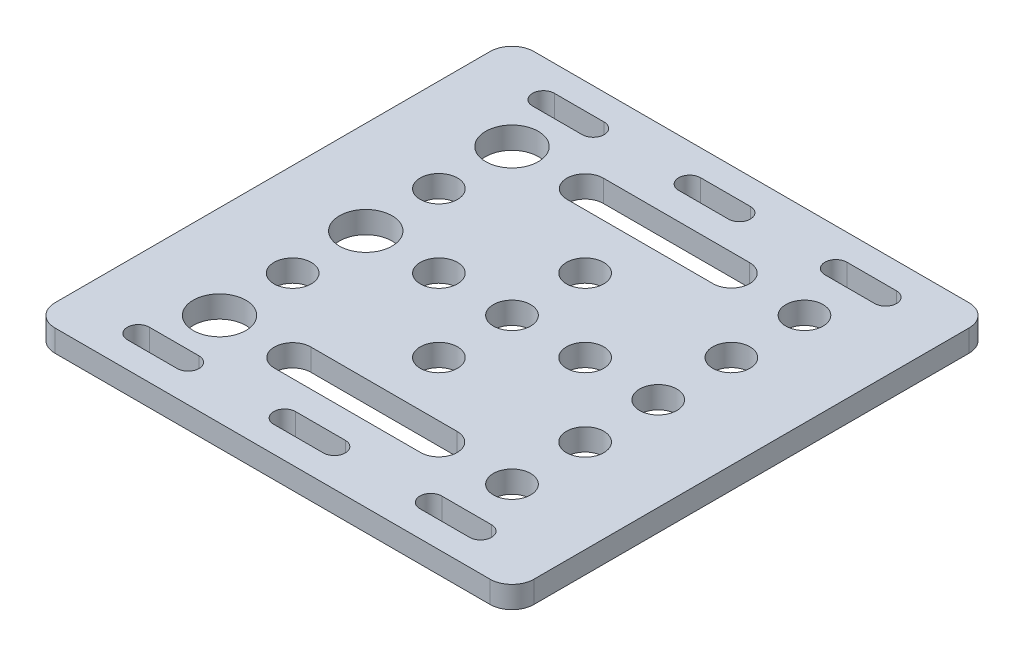
from build123d import *

# Parameters (mm, degrees)
BOSS_EXTRUDE1_DEPTH = 3
SKETCH2_R           = 2.55
SKETCH2_R_2         = 3.6
CUT_EXTRUDE1_DEPTH  = 47.412552181


with BuildPart() as part:
    # Sketch1 → Boss-Extrude1 (new body)
    with BuildSketch(Plane(origin=(0, 0, 0), x_dir=(1, 0, 0), z_dir=(0, 1, 0))):
        with BuildLine():
            Line((-29.75, 32.75), (29.75, 32.75))
            ThreePointArc((29.75, 32.75), (31.871320344, 31.871320344), (32.75, 29.75))
            Line((32.75, 29.75), (32.75, -29.75))
            ThreePointArc((32.75, -29.75), (31.871320344, -31.871320344), (29.75, -32.75))
            Line((29.75, -32.75), (-29.75, -32.75))
            ThreePointArc((-29.75, -32.75), (-31.871320344, -31.871320344), (-32.75, -29.75))
            Line((-32.75, -29.75), (-32.75, 29.75))
            ThreePointArc((-32.75, 29.75), (-31.871320344, 31.871320344), (-29.75, 32.75))
        make_face()
    extrude(amount=BOSS_EXTRUDE1_DEPTH)

    # Sketch2 → Cut-Extrude1 (cut, through all)
    with BuildSketch(Plane(origin=(0, 3, 0), x_dir=(1, 0, 0), z_dir=(0, 1, 0))):
        with Locations(Location((0, 0, 0), (0, 0, 270))):
            Circle(SKETCH2_R)
        with Locations(Location((-20, -20, 0), (0, 0, 270))):
            Circle(SKETCH2_R_2)
        with Locations(Location((-20, -10, 0), (0, 0, 270))):
            Circle(SKETCH2_R)
        with Locations(Location((-20, 0, 0), (0, 0, 270))):
            Circle(SKETCH2_R_2)
        with Locations(Location((-20, 10, 0), (0, 0, 270))):
            Circle(SKETCH2_R)
        with Locations(Location((-20, 20, 0), (0, 0, 270))):
            Circle(SKETCH2_R_2)
        with Locations(Location((-10, 0, 0), (0, 0, 270))):
            Circle(SKETCH2_R)
        with Locations(Location((10, 0, 0), (0, 0, 270))):
            Circle(SKETCH2_R)
        with Locations(Location((20, 0, 0), (0, 0, 270))):
            Circle(SKETCH2_R)
        with Locations(Location((0, -10, 0), (0, 0, 270))):
            Circle(SKETCH2_R)
        with Locations(Location((0, 10, 0), (0, 0, 270))):
            Circle(SKETCH2_R)
        with Locations(Location((20, -10, 0), (0, 0, 270))):
            Circle(SKETCH2_R)
        with Locations(Location((20, 10, 0), (0, 0, 270))):
            Circle(SKETCH2_R)
        with Locations(Location((20, 20, 0), (0, 0, 270))):
            Circle(SKETCH2_R)
        with Locations(Location((20, -20, 0), (0, 0, 270))):
            Circle(SKETCH2_R)
        with BuildLine():
            Line((-23.4, 29.2), (-16.6, 29.2))
            ThreePointArc((-16.6, 29.2), (-15.1, 27.7), (-16.6, 26.2))
            Line((-16.6, 26.2), (-23.4, 26.2))
            ThreePointArc((-23.4, 26.2), (-24.9, 27.7), (-23.4, 29.2))
        make_face()
        with BuildLine():
            Line((-3.4, 29.2), (3.4, 29.2))
            ThreePointArc((3.4, 29.2), (4.9, 27.7), (3.4, 26.2))
            Line((3.4, 26.2), (-3.4, 26.2))
            ThreePointArc((-3.4, 26.2), (-4.9, 27.7), (-3.4, 29.2))
        make_face()
        with BuildLine():
            Line((16.6, 29.2), (23.4, 29.2))
            ThreePointArc((23.4, 29.2), (24.9, 27.7), (23.4, 26.2))
            Line((23.4, 26.2), (16.6, 26.2))
            ThreePointArc((16.6, 26.2), (15.1, 27.7), (16.6, 29.2))
        make_face()
        with BuildLine():
            Line((-3.4, -26.2), (3.4, -26.2))
            ThreePointArc((3.4, -26.2), (4.9, -27.7), (3.4, -29.2))
            Line((3.4, -29.2), (-3.4, -29.2))
            ThreePointArc((-3.4, -29.2), (-4.9, -27.7), (-3.4, -26.2))
        make_face()
        with BuildLine():
            Line((16.6, -26.2), (23.4, -26.2))
            ThreePointArc((23.4, -26.2), (24.9, -27.7), (23.4, -29.2))
            Line((23.4, -29.2), (16.6, -29.2))
            ThreePointArc((16.6, -29.2), (15.1, -27.7), (16.6, -26.2))
        make_face()
        with BuildLine():
            Line((-23.4, -26.2), (-16.6, -26.2))
            ThreePointArc((-16.6, -26.2), (-15.1, -27.7), (-16.6, -29.2))
            Line((-16.6, -29.2), (-23.4, -29.2))
            ThreePointArc((-23.4, -29.2), (-24.9, -27.7), (-23.4, -26.2))
        make_face()
        with BuildLine():
            Line((-10, 22.5), (10, 22.5))
            ThreePointArc((10, 22.5), (12.5, 20), (10, 17.5))
            Line((10, 17.5), (-10, 17.5))
            ThreePointArc((-10, 17.5), (-12.5, 20), (-10, 22.5))
        make_face()
        with BuildLine():
            Line((10, -17.5), (-10, -17.5))
            ThreePointArc((-10, -17.5), (-12.5, -20), (-10, -22.5))
            Line((-10, -22.5), (10, -22.5))
            ThreePointArc((10, -22.5), (12.5, -20), (10, -17.5))
        make_face()
    extrude(amount=-CUT_EXTRUDE1_DEPTH, mode=Mode.SUBTRACT)


solid = part.part
